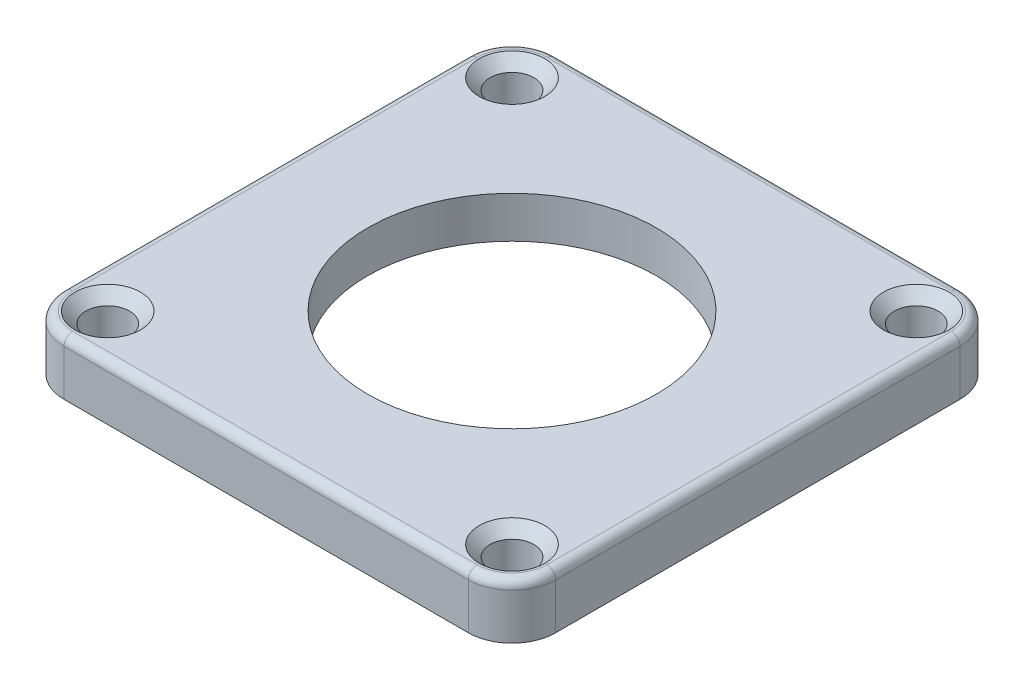
from build123d import *

# Parameters (mm, degrees)
SKETCH1_W                                         = 57.15
SKETCH1_H                                         = 57.15
BOSS_EXTRUDE2_DEPTH                               = 6.35
FILLET1_R                                         = 5.08
SKETCH2_R                                         = 19.05
CUT_EXTRUDE1_DEPTH                                = 1.524
CSK_FOR_1_FLAT_HEAD_MACHINE_SCREW_100_D           = 5.08
CSK_FOR_1_FLAT_HEAD_MACHINE_SCREW_100_CSINK_D     = 7.62
CSK_FOR_1_FLAT_HEAD_MACHINE_SCREW_100_CSINK_ANGLE = 90
SKETCH14_R                                        = 3.175
CUT_EXTRUDE2_DEPTH                                = 4.826
FILLET2_R                                         = 1.016
SKETCH15_R                                        = 16.764
CUT_EXTRUDE4_DEPTH                                = 4.826


with BuildPart() as part:
    # Sketch1 → Boss-Extrude2 (new body)
    with BuildSketch(Plane(origin=(0, 0, 0), x_dir=(1, 0, 0), z_dir=(0, 1, 0))):
        Rectangle(SKETCH1_W, SKETCH1_H)
    extrude(amount=BOSS_EXTRUDE2_DEPTH)

    # Fillet1
    fillet1_edges = [part.edges().sort_by_distance(p)[0] for p in [
        (28.575, 3.175, 28.575),
        (-28.575, 3.175, 28.575),
        (-28.575, 3.175, -28.575),
        (28.575, 3.175, -28.575),
    ]]
    fillet(fillet1_edges, radius=FILLET1_R)

    # Sketch2 → Cut-Extrude1 (cut)
    with BuildSketch(Plane.XZ):
        with Locations(Location((0, 0, 0), (0, 0, 270))):
            Circle(SKETCH2_R)
    extrude(amount=-CUT_EXTRUDE1_DEPTH, mode=Mode.SUBTRACT)

    # CSK for #1 Flat Head Machine Screw (100)2 (through all)
    with Locations(Plane(origin=(0, 6.35, 0), x_dir=(1, 0, 0), z_dir=(0, 1, 0))):
        with Locations((-23.495, 23.495), (23.495, 23.495), (-23.495, -23.495), (23.495, -23.495)):
            CounterSinkHole(CSK_FOR_1_FLAT_HEAD_MACHINE_SCREW_100_D / 2, CSK_FOR_1_FLAT_HEAD_MACHINE_SCREW_100_CSINK_D / 2, counter_sink_angle=CSK_FOR_1_FLAT_HEAD_MACHINE_SCREW_100_CSINK_ANGLE)

    # Sketch14 → Cut-Extrude2 (cut)
    with BuildSketch(Plane(origin=(0, 6.35, 0), x_dir=(1, 0, 0), z_dir=(0, 1, 0))):
        with Locations(Location((0, 0, 0), (0, 0, 270))):
            Circle(SKETCH14_R)
    extrude(amount=-CUT_EXTRUDE2_DEPTH, mode=Mode.SUBTRACT)

    # Fillet2
    fillet2_edges = [part.edges().sort_by_distance(p)[0] for p in [
        (0, 6.35, 28.575),
        (-28.575, 6.35, 0),
        (28.575, 6.35, 0),
        (0, 6.35, -28.575),
        (-27.087102448, 6.35, -27.087102448),
        (27.087102448, 6.35, -27.087102448),
        (27.087102448, 6.35, 27.087102448),
        (-27.087102448, 6.35, 27.087102448),
    ]]
    fillet(fillet2_edges, radius=FILLET2_R)

    # Sketch15 → Cut-Extrude4 (cut)
    with BuildSketch(Plane(origin=(0, 6.35, 0), x_dir=(1, 0, 0), z_dir=(0, 1, 0))):
        with Locations(Location((0, 0, 0), (0, 0, 270))):
            Circle(SKETCH15_R)
    extrude(amount=-CUT_EXTRUDE4_DEPTH, mode=Mode.SUBTRACT)


solid = part.part
